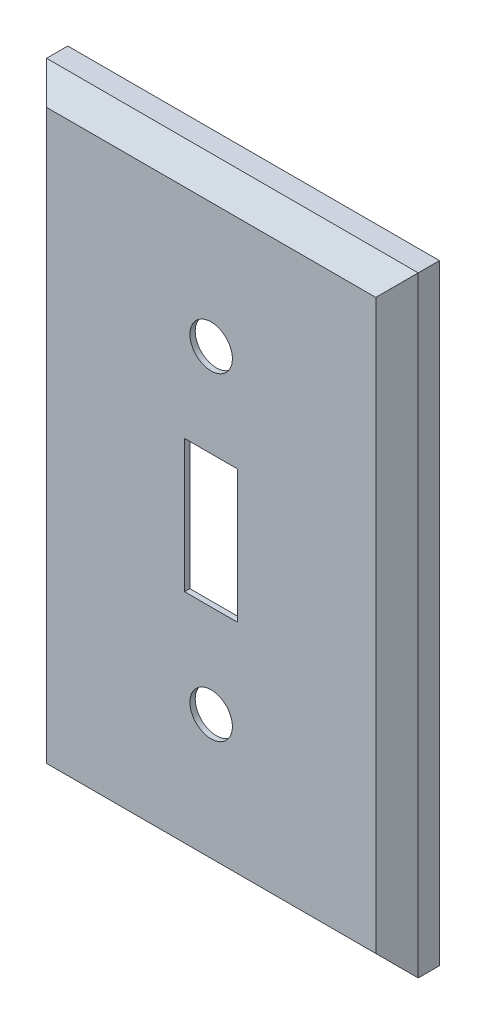
from build123d import *

# Parameters (mm, degrees)
CROQUIS1_W              = 70
CROQUIS1_H              = 115
SALIENTE_EXTRUIR1_DEPTH = 8
CHAFL_N1_SIZE           = 4
VACIADO1_T              = -1
CROQUIS2_R              = 4
CROQUIS2_W              = 10
CROQUIS2_H              = 25
CORTAR_EXTRUIR1_DEPTH   = 68.788273322


with BuildPart() as part:
    # Croquis1 → Saliente-Extruir1 (new body)
    with BuildSketch(Plane.XY):
        Rectangle(CROQUIS1_W, CROQUIS1_H)
    extrude(amount=SALIENTE_EXTRUIR1_DEPTH)

    # Chaflán1
    chafl_n1_edges = [part.edges().sort_by_distance(p)[0] for p in [
        (-35, 0, 8),
        (0, -57.5, 8),
        (35, 0, 8),
        (0, 57.5, 8),
    ]]
    chamfer(chafl_n1_edges, length=CHAFL_N1_SIZE)

    # Vaciado1
    vaciado1_openings = [part.faces().sort_by_distance(p)[0] for p in [
        (0, 0, 0),
    ]]
    offset(amount=VACIADO1_T, openings=vaciado1_openings, kind=Kind.INTERSECTION)

    # Croquis2 → Cortar-Extruir1 (cut, through all)
    with BuildSketch(Plane.XY.offset(8)):
        with Locations((0, 30)):
            Circle(CROQUIS2_R)
        with Locations((0, -30)):
            Circle(CROQUIS2_R)
        Rectangle(CROQUIS2_W, CROQUIS2_H)
    extrude(amount=-CORTAR_EXTRUIR1_DEPTH, mode=Mode.SUBTRACT)


solid = part.part
